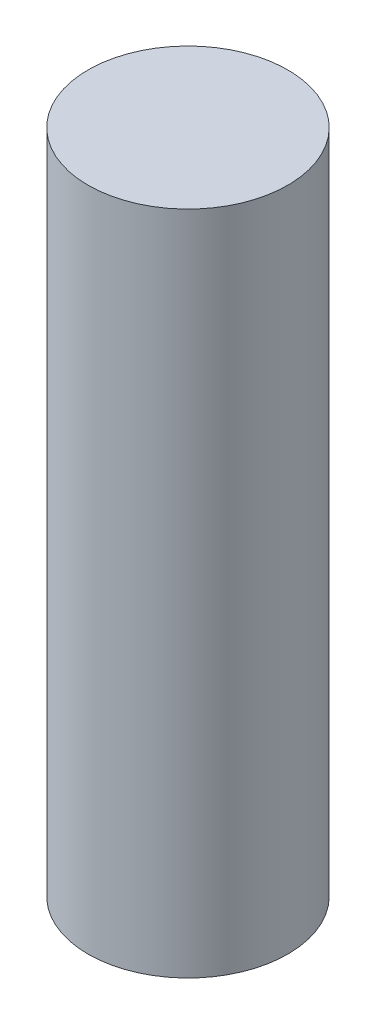
from build123d import *

# Parameters (mm, degrees)
SKETCH1_R           = 9.525
BOSS_EXTRUDE1_DEPTH = 63.5


with BuildPart() as part:
    # Sketch1 → Boss-Extrude1 (new body)
    with BuildSketch(Plane(origin=(0, 0, 0), x_dir=(1, 0, 0), z_dir=(0, 1, 0))):
        with Locations(Location((0, 0, 0), (0, 0, 270))):
            Circle(SKETCH1_R)
    extrude(amount=BOSS_EXTRUDE1_DEPTH)


solid = part.part
